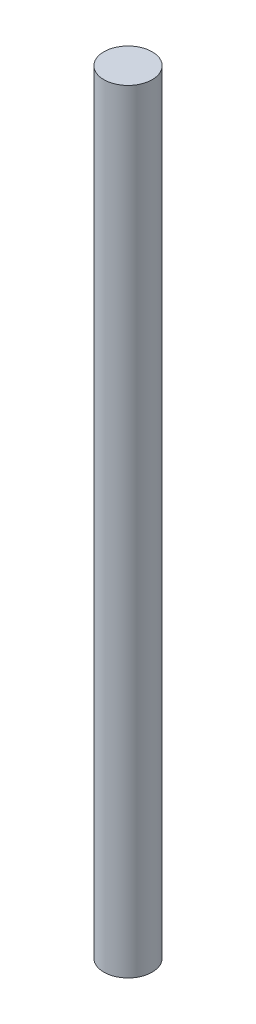
from build123d import *

# Parameters (mm, degrees)
SKETCH1_R           = 76.2
BOSS_EXTRUDE1_DEPTH = 2438.4


with BuildPart() as part:
    # Sketch1 → Boss-Extrude1 (new body)
    with BuildSketch(Plane(origin=(0, 0, 0), x_dir=(1, 0, 0), z_dir=(0, 1, 0))):
        with Locations(Location((0, 0, 0), (0, 0, 90))):
            Circle(SKETCH1_R)
    extrude(amount=BOSS_EXTRUDE1_DEPTH)


solid = part.part
